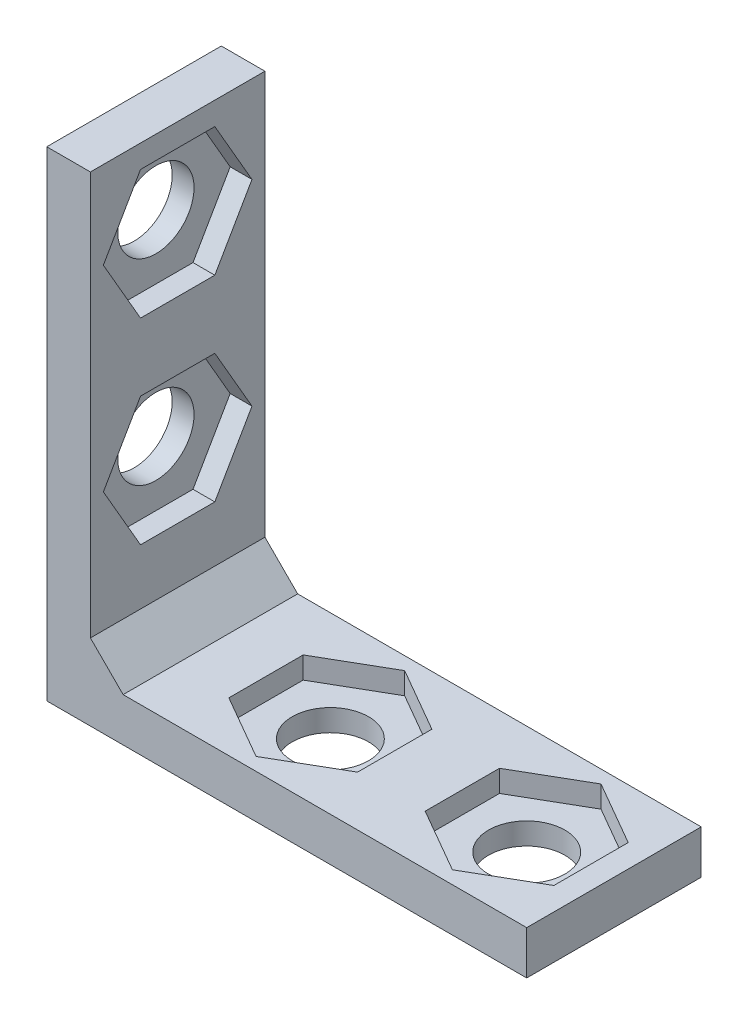
from build123d import *

# Parameters (mm, degrees)
ESTRUSIONE_ESTRUSIONE1_DEPTH = 8
TAGLIO_ESTRUSIONE1_DEPTH     = 1
SCHIZZO4_R                   = 1.75
TAGLIO_ESTRUSIONE2_DEPTH     = 32.448370387
TAGLIO_ESTRUSIONE3_DEPTH     = 1
SCHIZZO6_R                   = 1.75
TAGLIO_ESTRUSIONE4_DEPTH     = 32.448370387
SMUSSO1_SIZE                 = 1.5


with BuildPart() as part:
    # Schizzo1 → Estrusione-Estrusione1 (new body)
    with BuildSketch(Plane.XY):
        Polygon((0, 0), (0, 22), (2, 22), (2, 2), (22, 2), (22, 0), align=None)
    extrude(amount=ESTRUSIONE_ESTRUSIONE1_DEPTH)

    # Schizzo2 → Taglio-Estrusione1 (cut)
    with BuildSketch(Plane(origin=(2, 0, 0), x_dir=(0, 0, -1), z_dir=(1, 0, 0))):
        Polygon((-2.296816706, 15.05), (-0.593633412, 18), (-2.296816706, 20.95), (-5.703183294, 20.95), (-7.406366588, 18), (-5.703183294, 15.05), align=None)
        Polygon((-2.296816706, 6.05), (-0.593633412, 9), (-2.296816706, 11.95), (-5.703183294, 11.95), (-7.406366588, 9), (-5.703183294, 6.05), align=None)
    extrude(amount=-TAGLIO_ESTRUSIONE1_DEPTH, mode=Mode.SUBTRACT)

    # Schizzo4 → Taglio-Estrusione2 (cut, through all)
    with BuildSketch(Plane(origin=(1, 0, 0), x_dir=(0, 0, -1), z_dir=(1, 0, 0))):
        with Locations((-4, 18)):
            Circle(SCHIZZO4_R)
        with Locations((-4, 9)):
            Circle(SCHIZZO4_R)
    extrude(amount=-TAGLIO_ESTRUSIONE2_DEPTH, mode=Mode.SUBTRACT)

    # Schizzo5 → Taglio-Estrusione3 (cut)
    with BuildSketch(Plane(origin=(0, 2, 0), x_dir=(1, 0, 0), z_dir=(0, 1, 0))):
        Polygon((15.05, -5.703183294), (18, -7.406366588), (20.95, -5.703183294), (20.95, -2.296816706), (18, -0.593633412), (15.05, -2.296816706), align=None)
        Polygon((6.05, -5.703183294), (9, -7.406366588), (11.95, -5.703183294), (11.95, -2.296816706), (9, -0.593633412), (6.05, -2.296816706), align=None)
    extrude(amount=-TAGLIO_ESTRUSIONE3_DEPTH, mode=Mode.SUBTRACT)

    # Schizzo6 → Taglio-Estrusione4 (cut, through all)
    with BuildSketch(Plane(origin=(0, 1, 0), x_dir=(1, 0, 0), z_dir=(0, 1, 0))):
        with Locations(Location((18, -4, 0), (0, 0, 270))):
            Circle(SCHIZZO6_R)
        with Locations(Location((9, -4, 0), (0, 0, 270))):
            Circle(SCHIZZO6_R)
    extrude(amount=-TAGLIO_ESTRUSIONE4_DEPTH, mode=Mode.SUBTRACT)

    # Smusso1
    smusso1_edges = [part.edges().sort_by_distance(p)[0] for p in [
        (2, 2, 4),
    ]]
    chamfer(smusso1_edges, length=SMUSSO1_SIZE)


solid = part.part
